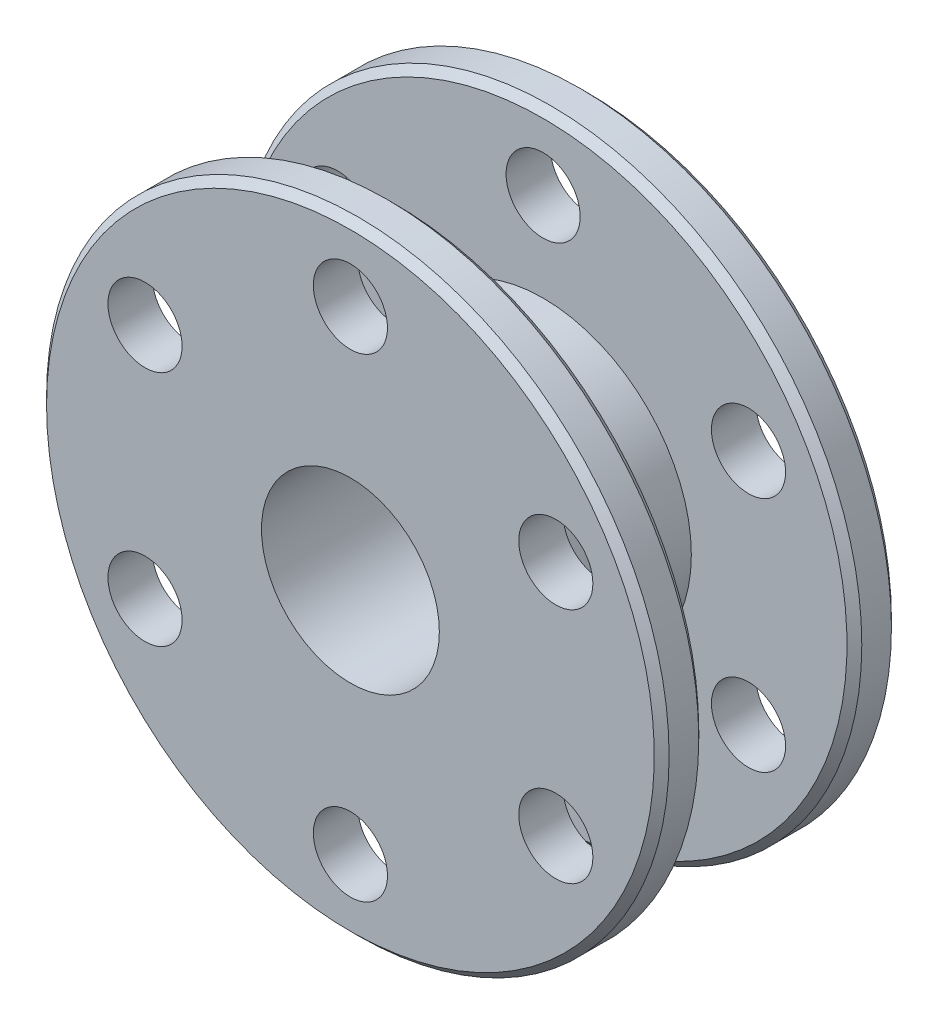
from build123d import *

# Parameters (mm, degrees)
CHAMFER1_SIZE           = 0.5
CUT_EXTRUDE1_DEPTH      = 34.734255587
CUT_EXTRUDE1_DEPTH_BACK = 34.734255587
SKETCH2_R               = 2.5


with BuildPart() as part:
    # Sketch1 → Revolve1 (revolve)
    with BuildSketch(Plane(origin=(0, 0, 0), x_dir=(0, 0, -1), z_dir=(1, 0, 0)), mode=Mode.PRIVATE) as revolve1_sk:
        Polygon((-13.248601431, 6), (-13.248601431, 21), (-10.248601431, 21), (-10.248601431, 10), (-0.248601431, 10), (-0.248601431, 21), (2.751398569, 21), (2.751398569, 6), align=None)
    revolve(revolve1_sk.sketch.rotate(Axis((0, 0, 24.790681623), (0, 0, -1)), 90), axis=Axis((0, 0, 24.790681623), (0, 0, -1)))

    # Chamfer1
    chamfer1_edges = [part.edges().sort_by_distance(p)[0] for p in [
        (-21, 0, -2.751398569),
        (-21, 0, 0.248601431),
        (-21, 0, 10.248601431),
        (-21, 0, 13.248601431),
    ]]
    chamfer(chamfer1_edges, length=CHAMFER1_SIZE)

    # Sketch2 → Cut-Extrude1 (cut, two sides: drawn at the far end of the back side and taken through both)
    with BuildSketch(Plane.XY.offset(13.248601431).offset(-CUT_EXTRUDE1_DEPTH_BACK)):
        with Locations((0, 16)):
            Circle(SKETCH2_R)
        with Locations((13.856406461, 8)):
            Circle(SKETCH2_R)
        with Locations((13.856406461, -8)):
            Circle(SKETCH2_R)
        with Locations((0, -16)):
            Circle(SKETCH2_R)
        with Locations((-13.856406461, -8)):
            Circle(SKETCH2_R)
        with Locations((-13.856406461, 8)):
            Circle(SKETCH2_R)
    extrude(amount=CUT_EXTRUDE1_DEPTH + CUT_EXTRUDE1_DEPTH_BACK, mode=Mode.SUBTRACT)


solid = part.part
